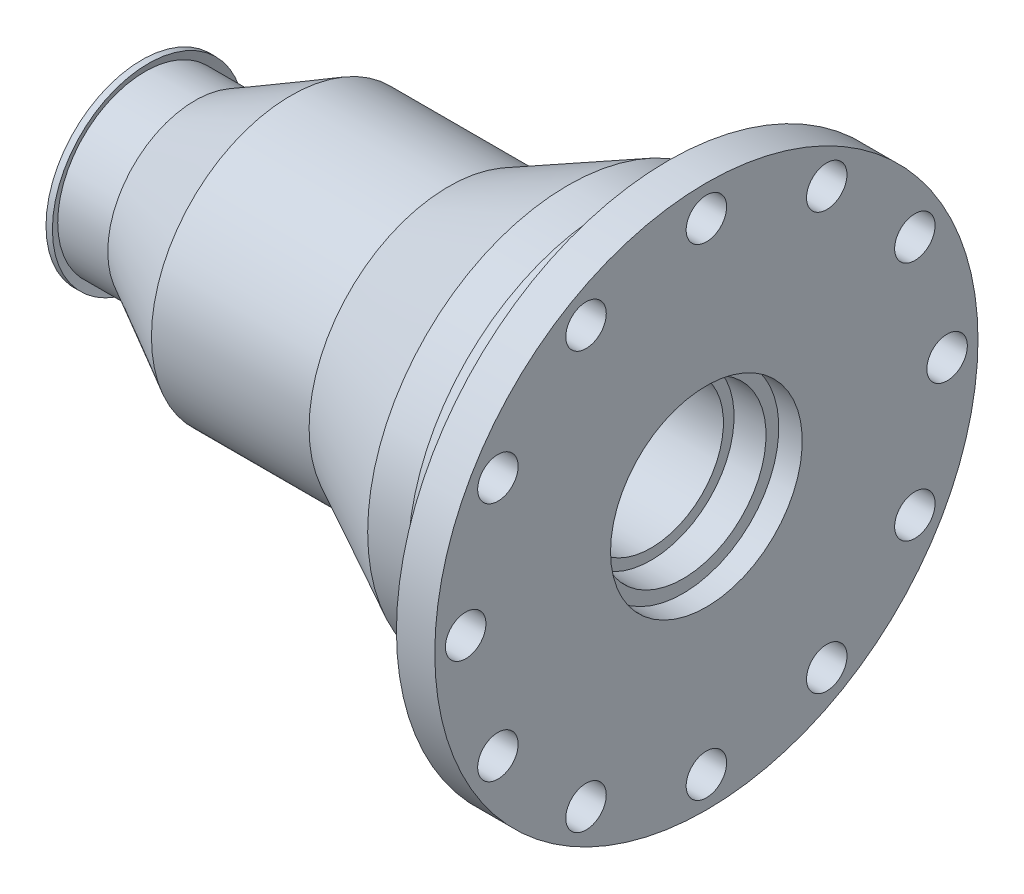
from build123d import *

# Parameters (mm, degrees)
SKETCH_3_R           = 9.5
CUT_EXTRUDE_1_DEPTH  = 321.526909947
SKETCH_4_R           = 9.5
CUT_EXTRUDE_2_DEPTH  = 321.526909947
SKETCH_5_R           = 9.5
CUT_EXTRUDE_3_DEPTH  = 321.526909947
SKETCH_6_R           = 9.5
CUT_EXTRUDE_4_DEPTH  = 321.526909947
SKETCH_7_R           = 9.5
CUT_EXTRUDE_5_DEPTH  = 321.526909947
SKETCH_8_R           = 9.5
CUT_EXTRUDE_6_DEPTH  = 321.526909947
SKETCH_9_R           = 9.5
CUT_EXTRUDE_7_DEPTH  = 321.526909947
SKETCH_10_R          = 9.5
CUT_EXTRUDE_8_DEPTH  = 321.526909947
SKETCH_11_R          = 9.5
CUT_EXTRUDE_9_DEPTH  = 321.526909947
SKETCH_12_R          = 9.5
CUT_EXTRUDE_10_DEPTH = 321.526909947
SKETCH_13_R          = 9.5
CUT_EXTRUDE_11_DEPTH = 321.526909947
SKETCH_14_R          = 9.5
CUT_EXTRUDE_12_DEPTH = 321.526909947


with BuildPart() as part:
    # Эскиз1 → Повернуть1 (revolve)
    with BuildSketch(Plane.XY, mode=Mode.PRIVATE) as revolve_1_sk:
        Polygon((0, 0), (265, 0), (265, 127.5), (247, 127.5), (247, 100), (239, 100), (239, 95), (220, 95), (220, 94), (200, 94), (144, 65.5), (70, 65.5), (25, 41), (1.5, 41), (3, 45), (0, 45), align=None)
    revolve(revolve_1_sk.sketch.rotate(Axis((0, 0, 0), (1, 0, 0)), 90), axis=Axis((0, 0, 0), (1, 0, 0)))

    # Эскиз2 → Вырез-Повернуть1 (revolve, cut)
    with BuildSketch(Plane.XY, mode=Mode.PRIVATE) as cut_revolve_1_sk:
        Polygon((0, 0), (265, 0), (265, 45), (254, 45), (254, 39), (239, 39), (239, 34), (203.5, 34), (203.5, 31), (0, 31), align=None)
    revolve(cut_revolve_1_sk.sketch.rotate(Axis((0, 0, 0), (1, 0, 0)), 90), axis=Axis((0, 0, 0), (1, 0, 0)), mode=Mode.SUBTRACT)

    # Эскиз3 → Вырез-Вытянуть1 (cut, through all)
    with BuildSketch(Plane(origin=(0, 0, 0), x_dir=(0, 0, -1), z_dir=(1, 0, 0))):
        with Locations((0, 113)):
            Circle(SKETCH_3_R)
    extrude(amount=CUT_EXTRUDE_1_DEPTH, mode=Mode.SUBTRACT)

    # Эскиз4 → Вырез-Вытянуть2 (cut, through all)
    with BuildSketch(Plane(origin=(0, 0, 0), x_dir=(0, 0, -1), z_dir=(1, 0, 0))):
        with Locations((-56.5, 97.860870628)):
            Circle(SKETCH_4_R)
    extrude(amount=CUT_EXTRUDE_2_DEPTH, mode=Mode.SUBTRACT)

    # Эскиз5 → Вырез-Вытянуть3 (cut, through all)
    with BuildSketch(Plane(origin=(0, 0, 0), x_dir=(0, 0, -1), z_dir=(1, 0, 0))):
        with Locations((-97.860870628, 56.5)):
            Circle(SKETCH_5_R)
    extrude(amount=CUT_EXTRUDE_3_DEPTH, mode=Mode.SUBTRACT)

    # Эскиз6 → Вырез-Вытянуть4 (cut, through all)
    with BuildSketch(Plane(origin=(0, 0, 0), x_dir=(0, 0, -1), z_dir=(1, 0, 0))):
        with Locations((-113, 0)):
            Circle(SKETCH_6_R)
    extrude(amount=CUT_EXTRUDE_4_DEPTH, mode=Mode.SUBTRACT)

    # Эскиз7 → Вырез-Вытянуть5 (cut, through all)
    with BuildSketch(Plane(origin=(0, 0, 0), x_dir=(0, 0, -1), z_dir=(1, 0, 0))):
        with Locations((-97.860870628, -56.5)):
            Circle(SKETCH_7_R)
    extrude(amount=CUT_EXTRUDE_5_DEPTH, mode=Mode.SUBTRACT)

    # Эскиз8 → Вырез-Вытянуть6 (cut, through all)
    with BuildSketch(Plane(origin=(0, 0, 0), x_dir=(0, 0, -1), z_dir=(1, 0, 0))):
        with Locations((-56.5, -97.860870628)):
            Circle(SKETCH_8_R)
    extrude(amount=CUT_EXTRUDE_6_DEPTH, mode=Mode.SUBTRACT)

    # Эскиз9 → Вырез-Вытянуть7 (cut, through all)
    with BuildSketch(Plane(origin=(0, 0, 0), x_dir=(0, 0, -1), z_dir=(1, 0, 0))):
        with Locations((0, -113)):
            Circle(SKETCH_9_R)
    extrude(amount=CUT_EXTRUDE_7_DEPTH, mode=Mode.SUBTRACT)

    # Эскиз10 → Вырез-Вытянуть8 (cut, through all)
    with BuildSketch(Plane(origin=(0, 0, 0), x_dir=(0, 0, -1), z_dir=(1, 0, 0))):
        with Locations((56.5, -97.860870628)):
            Circle(SKETCH_10_R)
    extrude(amount=CUT_EXTRUDE_8_DEPTH, mode=Mode.SUBTRACT)

    # Эскиз11 → Вырез-Вытянуть9 (cut, through all)
    with BuildSketch(Plane(origin=(0, 0, 0), x_dir=(0, 0, -1), z_dir=(1, 0, 0))):
        with Locations((97.860870628, -56.5)):
            Circle(SKETCH_11_R)
    extrude(amount=CUT_EXTRUDE_9_DEPTH, mode=Mode.SUBTRACT)

    # Эскиз12 → Вырез-Вытянуть10 (cut, through all)
    with BuildSketch(Plane(origin=(0, 0, 0), x_dir=(0, 0, -1), z_dir=(1, 0, 0))):
        with Locations((113, 0)):
            Circle(SKETCH_12_R)
    extrude(amount=CUT_EXTRUDE_10_DEPTH, mode=Mode.SUBTRACT)

    # Эскиз13 → Вырез-Вытянуть11 (cut, through all)
    with BuildSketch(Plane(origin=(0, 0, 0), x_dir=(0, 0, -1), z_dir=(1, 0, 0))):
        with Locations((97.860870628, 56.5)):
            Circle(SKETCH_13_R)
    extrude(amount=CUT_EXTRUDE_11_DEPTH, mode=Mode.SUBTRACT)

    # Эскиз14 → Вырез-Вытянуть12 (cut, through all)
    with BuildSketch(Plane(origin=(0, 0, 0), x_dir=(0, 0, -1), z_dir=(1, 0, 0))):
        with Locations((56.5, 97.860870628)):
            Circle(SKETCH_14_R)
    extrude(amount=CUT_EXTRUDE_12_DEPTH, mode=Mode.SUBTRACT)


solid = part.part
